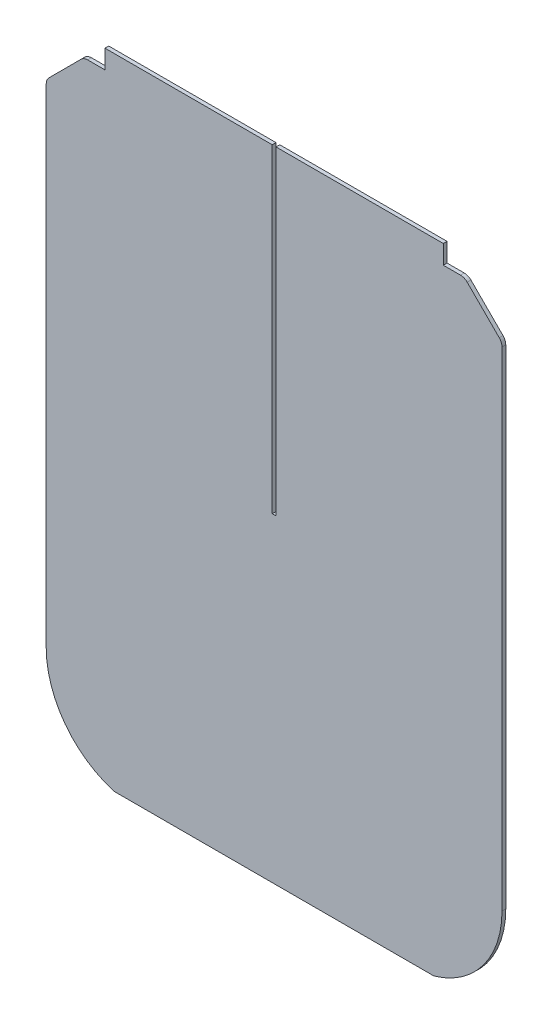
from build123d import *

# Parameters (mm, degrees)
BOSS_EXTRUDE1_DEPTH = 0.8
FILLET1_R           = 2


with BuildPart() as part:
    # Sketch1 → Boss-Extrude1 (new body)
    with BuildSketch(Plane.XY):
        with BuildLine():
            Line((14.5, 0), (82.5, 0))
            ThreePointArc((82.5, 0), (92.968719423, 7.187289944), (97, 19.228884523))
            Line((97, 19.228884523), (97, 124))
            Line((97, 124), (89, 132))
            Line((89, 132), (84.5, 132))
            Line((84.5, 132), (84.5, 136))
            Line((84.5, 136), (48.9, 136))
            Line((48.9, 136), (48.9, 68))
            Line((48.9, 68), (48.1, 68))
            Line((48.1, 68), (48.1, 136))
            Line((48.1, 136), (12.5, 136))
            Line((12.5, 136), (12.5, 132))
            Line((12.5, 132), (8, 132))
            Line((8, 132), (0, 124))
            Line((0, 124), (0, 19.228884523))
            ThreePointArc((0, 19.228884523), (4.031280577, 7.187289944), (14.5, 0))
        make_face()
    extrude(amount=BOSS_EXTRUDE1_DEPTH)

    # Fillet1
    fillet1_edges = [part.edges().sort_by_distance(p)[0] for p in [
        (89, 132, 0.4),
        (97, 124, 0.4),
        (0, 124, 0.4),
        (8, 132, 0.4),
    ]]
    fillet(fillet1_edges, radius=FILLET1_R)


solid = part.part
